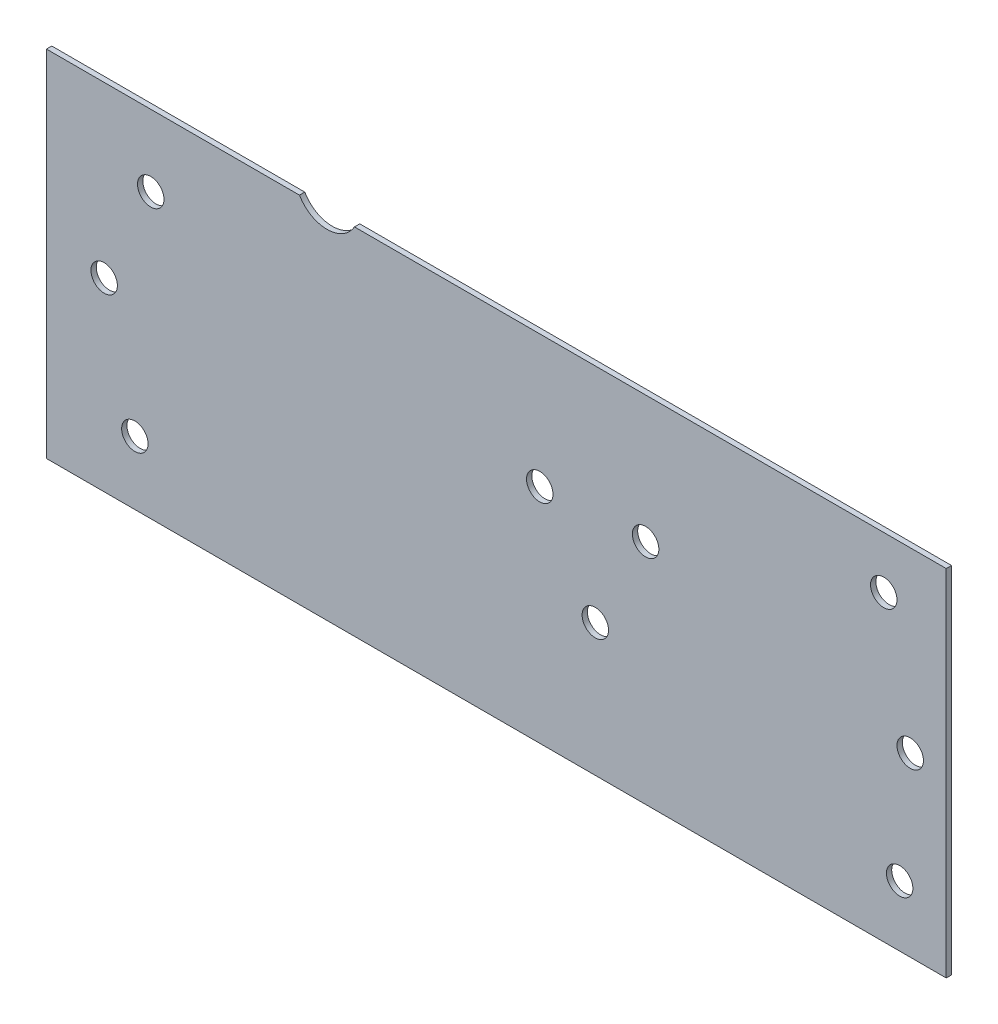
from build123d import *

# Parameters (mm, degrees)
SKETCH1_R           = 2.5
BOSS_EXTRUDE1_DEPTH = 1


with BuildPart() as part:
    # Sketch1 → Boss-Extrude1 (new body)
    with BuildSketch(Plane.XY):
        with BuildLine():
            ThreePointArc((-26.803847577, 33.5), (-29, 31.303847577), (-32, 30.5))
            ThreePointArc((-32, 30.5), (-35, 31.303847577), (-37.196152423, 33.5))
            Line((-37.196152423, 33.5), (-85, 33.5))
            Line((-85, 33.5), (-85, -33.5))
            Line((-85, -33.5), (85, -33.5))
            Line((85, -33.5), (85, 33.5))
            Line((85, 33.5), (-26.803847577, 33.5))
        make_face()
        with Locations((-68.3, -21.5)):
            Circle(SKETCH1_R, mode=Mode.SUBTRACT)
        with Locations((-74.1, 1.5)):
            Circle(SKETCH1_R, mode=Mode.SUBTRACT)
        with Locations((76.2, -22)):
            Circle(SKETCH1_R, mode=Mode.SUBTRACT)
        with Locations((18.7, -8.5)):
            Circle(SKETCH1_R, mode=Mode.SUBTRACT)
        with Locations((78.2, -0.1)):
            Circle(SKETCH1_R, mode=Mode.SUBTRACT)
        with Locations((-65.3, 20)):
            Circle(SKETCH1_R, mode=Mode.SUBTRACT)
        with Locations((8.2, 8.5)):
            Circle(SKETCH1_R, mode=Mode.SUBTRACT)
        with Locations((28.2, 9.5)):
            Circle(SKETCH1_R, mode=Mode.SUBTRACT)
        with Locations((73.2, 23.7)):
            Circle(SKETCH1_R, mode=Mode.SUBTRACT)
    extrude(amount=BOSS_EXTRUDE1_DEPTH)


solid = part.part
